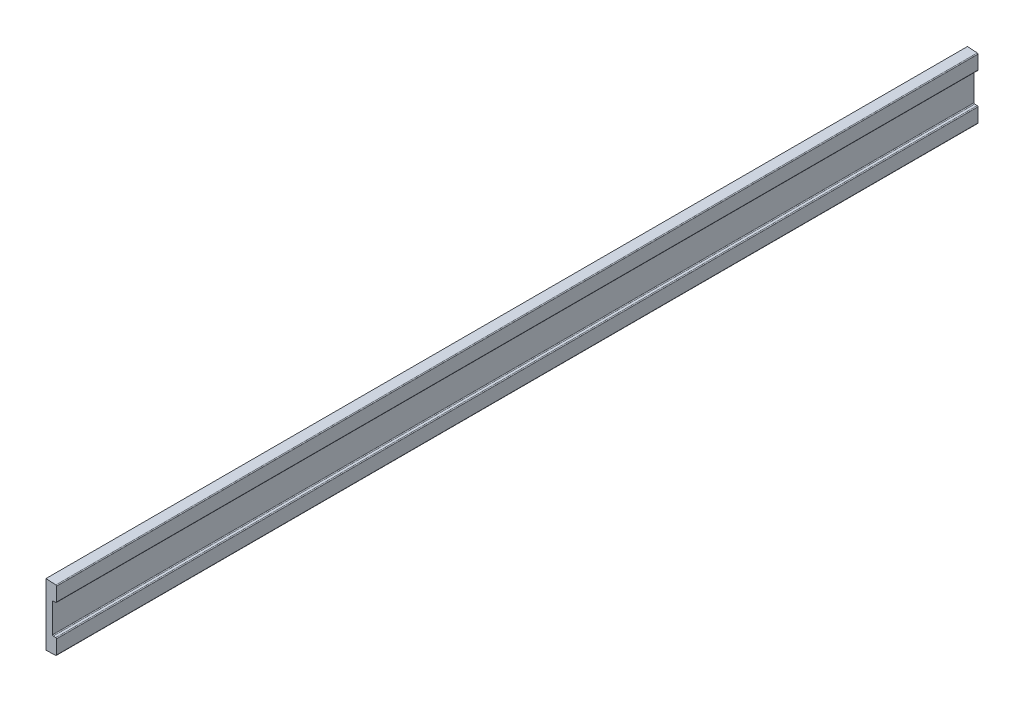
from build123d import *

# Parameters (mm, degrees)
BOSS_EXTRUDE1_DEPTH = 177.8
CUT_EXTRUDE1_REACH  = 236.418
SKETCH3_W           = 0.7874
SKETCH3_H           = 5.8674
FILLET1_R           = 0.15875


with BuildPart() as part:
    # Sketch1 → Boss-Extrude1 (new body)
    with BuildSketch(Plane.XY):
        with BuildLine():
            Line((151.898604, 0.02286), (152.4, 0))
            add(Edge.make_bspline(
                [(152.4, 0), (152.232833718, 0.018502415), (151.571843934, 0.091662545), (150.113999557, 0.2838596), (147.749385864, 0.638650629), (144.555943786, 1.170157002), (140.615360499, 1.859099247), (136.007834995, 2.67146013), (130.806388019, 3.562840017), (125.073826155, 4.486154777), (118.864690135, 5.397753278), (112.233312125, 6.272974236), (105.243489487, 7.106058892), (97.969665406, 7.889319693), (90.492724993, 8.606734858), (82.895253241, 9.240670251), (75.258667902, 9.77749908), (67.662928423, 10.198815718), (60.186827499, 10.49170102), (52.905945954, 10.645080099), (45.891743713, 10.644551806), (39.210681048, 10.486247597), (32.923263797, 10.164412711), (27.083700854, 9.670939726), (21.73719754, 9.016508091), (16.924344759, 8.204081974), (12.676275305, 7.249770479), (9.019815693, 6.174457771), (5.965694819, 5.002018522), (3.544032537, 3.769871526), (1.704834708, 2.531499726), (0.575239506, 1.344737529), (-0.170728015, 0.20310696), (0.337603285, -1.001772228), (1.792943226, -1.546726795), (3.794232235, -2.17716446), (6.643400201, -2.643922316), (10.216110654, -3.041953632), (14.530084187, -3.319872228), (19.533969629, -3.497677255), (25.18692206, -3.577638345), (31.428627275, -3.573848082), (38.191948203, -3.496581442), (45.401595317, -3.349308986), (52.97841726, -3.141841288), (60.83867414, -2.885262261), (68.894988424, -2.587930905), (77.057432025, -2.258882887), (85.235009672, -1.907730283), (93.335426834, -1.550168819), (101.266049649, -1.195465221), (108.93417081, -0.862411006), (116.2464986, -0.557504045), (123.110150899, -0.306936183), (129.431690533, -0.107922528), (135.123521438, 0.027974451), (140.103603919, 0.108900525), (144.29941542, 0.13993859), (147.644768246, 0.124243061), (150.083437285, 0.086502888), (151.399782071, 0.04034956), (151.898604, 0.02286)],
                knots=[0, 0, 0, 0, 0.001635356, 0.006466337, 0.014296592, 0.024884209, 0.037943993, 0.053194137, 0.070376569, 0.089257218, 0.109651763, 0.131396199, 0.15429467, 0.178096903, 0.202530723, 0.227328973, 0.252225807, 0.276966075, 0.301296827, 0.324972089, 0.347773046, 0.369493849, 0.389946985, 0.408979416, 0.42646579, 0.442306729, 0.45642124, 0.468773538, 0.47934515, 0.488155641, 0.495223141, 0.500608248, 0.504417036, 0.507344225, 0.511892731, 0.518766333, 0.5280624, 0.539750485, 0.553781924, 0.570059197, 0.588441486, 0.608747967, 0.630750044, 0.65420771, 0.678865071, 0.70445057, 0.730677503, 0.757253937, 0.783882587, 0.810265561, 0.836095192, 0.861073222, 0.884896986, 0.907258357, 0.92785625, 0.946394646, 0.962618154, 0.976286171, 0.987192828, 0.99514679, 1, 1, 1, 1], degree=3))
        make_face()
    extrude(amount=BOSS_EXTRUDE1_DEPTH)

    # Sketch3 → Cut-Extrude1 (cut, up to next)
    with BuildSketch(Plane.XY.offset(177.8), mode=Mode.PRIVATE) as cut_extrude1_sk1:
        with BuildLine():
            Line((76.2, -2.290863726), (76.2, 9.698555773))
            add(Edge.make_bspline(
                [(76.2, 9.698555773), (75.880486903, 9.71922899), (73.021718792, 9.901577043), (67.662928423, 10.198815718), (60.186827499, 10.49170102), (52.905945954, 10.645080099), (45.891743713, 10.644551806), (39.210681048, 10.486247597), (32.923263797, 10.164412711), (27.083700854, 9.670939726), (21.73719754, 9.016508091), (16.924344759, 8.204081974), (12.676275305, 7.249770479), (9.019815693, 6.174457771), (5.965694819, 5.002018522), (3.544032537, 3.769871526), (1.704834708, 2.531499726), (0.575239506, 1.344737529), (-0.170728015, 0.20310696), (0.337603285, -1.001772228), (1.792943226, -1.546726795), (3.794232235, -2.17716446), (6.643400201, -2.643922316), (10.216110654, -3.041953632), (14.530084187, -3.319872228), (19.533969629, -3.497677255), (25.18692206, -3.577638345), (31.428627275, -3.573848082), (38.191948203, -3.496581442), (45.401595317, -3.349308986), (52.97841726, -3.141841288), (60.83867414, -2.885262261), (68.610964891, -2.598413254), (73.753094803, -2.392038155), (76.2, -2.290863726)],
                knots=[0.249112544, 0.249112544, 0.249112544, 0.249112544, 0.252225807, 0.276966075, 0.301296827, 0.324972089, 0.347773046, 0.369493849, 0.389946985, 0.408979416, 0.42646579, 0.442306729, 0.45642124, 0.468773538, 0.47934515, 0.488155641, 0.495223141, 0.500608248, 0.504417036, 0.507344225, 0.511892731, 0.518766333, 0.5280624, 0.539750485, 0.553781924, 0.570059197, 0.588441486, 0.608747967, 0.630750044, 0.65420771, 0.678865071, 0.70445057, 0.730677503, 0.754490355, 0.754490355, 0.754490355, 0.754490355], degree=3))
        make_face()
    cut_extrude1_tool1 = extrude(cut_extrude1_sk1.sketch, amount=-CUT_EXTRUDE1_REACH, mode=Mode.PRIVATE) & part.part
    # Sketch3 → Cut-Extrude1 (cut, up to next)
    with BuildSketch(Plane.XY.offset(177.8), mode=Mode.PRIVATE) as cut_extrude1_sk2:
        with BuildLine():
            add(Edge.make_bspline(
                [(152.329043318, 0.007856204), (152.185531128, 0.023755853), (151.548249147, 0.094773199), (150.113999557, 0.2838596), (147.749385864, 0.638650629), (144.555943786, 1.170157002), (140.615360499, 1.859099247), (136.007834995, 2.67146013), (130.806388019, 3.562840017), (125.073826155, 4.486154777), (118.864690135, 5.397753278), (112.233312125, 6.272974236), (105.243489487, 7.106058892), (97.969665406, 7.889319693), (90.492724993, 8.606734858), (83.890828887, 9.157599111), (79.789825298, 9.456414677), (78.232, 9.563171971)],
                knots=[0.000231386, 0.000231386, 0.000231386, 0.000231386, 0.001635356, 0.006466337, 0.014296592, 0.024884209, 0.037943993, 0.053194137, 0.070376569, 0.089257218, 0.109651763, 0.131396199, 0.15429467, 0.178096903, 0.202530723, 0.227328973, 0.242511926, 0.242511926, 0.242511926, 0.242511926], degree=3))
            Line((78.232, 9.563171971), (78.232, 6.637546024))
            Line((78.232, 6.637546024), (78.232, 0.770146024))
            Line((78.232, 0.770146024), (78.232, -2.206181248))
            add(Edge.make_bspline(
                [(78.232, -2.206181248), (80.57481261, -2.107809283), (85.628331607, -1.890368614), (93.335426834, -1.550168819), (101.266049649, -1.195465221), (108.93417081, -0.862411006), (116.2464986, -0.557504045), (123.110150899, -0.306936183), (129.431690533, -0.107922528), (135.123521438, 0.027974451), (140.103603919, 0.108900525), (144.29941542, 0.13993859), (147.644768246, 0.124243061), (150.083437285, 0.086502888), (151.399782071, 0.04034956), (151.898604, 0.02286)],
                knots=[0.761082134, 0.761082134, 0.761082134, 0.761082134, 0.783882587, 0.810265561, 0.836095192, 0.861073222, 0.884896986, 0.907258357, 0.92785625, 0.946394646, 0.962618154, 0.976286171, 0.987192828, 0.99514679, 1, 1, 1, 1], degree=3))
            Line((151.898604, 0.02286), (152.4, 0))
            add(Edge.make_bspline(
                [(152.4, 0), (152.376347675, 0.002617903), (152.352695351, 0.005235806), (152.329043318, 0.007856204)],
                knots=[0, 0, 0, 0, 0.000231386, 0.000231386, 0.000231386, 0.000231386], degree=3))
        make_face()
    cut_extrude1_tool2 = extrude(cut_extrude1_sk2.sketch, amount=-CUT_EXTRUDE1_REACH, mode=Mode.PRIVATE) & part.part
    # Sketch3 → Cut-Extrude1 (cut, up to next)
    with BuildSketch(Plane.XY.offset(177.8), mode=Mode.PRIVATE) as cut_extrude1_sk3:
        with Locations((77.8383, 3.703846024)):
            Rectangle(SKETCH3_W, SKETCH3_H)
    cut_extrude1_tool3 = extrude(cut_extrude1_sk3.sketch, amount=-CUT_EXTRUDE1_REACH, mode=Mode.PRIVATE) & part.part
    add(cut_extrude1_tool1.solids().sort_by_distance((41.071648, 3.198464, 177.8))[0], mode=Mode.SUBTRACT)
    add(cut_extrude1_tool2.solids().sort_by_distance((102.964201, 2.96286, 177.8))[0], mode=Mode.SUBTRACT)
    add(cut_extrude1_tool3.solids().sort_by_distance((77.8383, 3.703846, 177.8))[0], mode=Mode.SUBTRACT)

    # Fillet1
    fillet1_edges = [part.edges().sort_by_distance(p)[0] for p in [
        (78.232, -2.206181248, 88.9),
        (78.232, 9.563171971, 88.9),
        (78.232, 0.770146024, 88.9),
        (77.4446, 0.770146024, 88.9),
        (78.232, 6.637546024, 88.9),
        (77.4446, 6.637546024, 88.9),
    ]]
    fillet(fillet1_edges, radius=FILLET1_R)


solid = part.part
